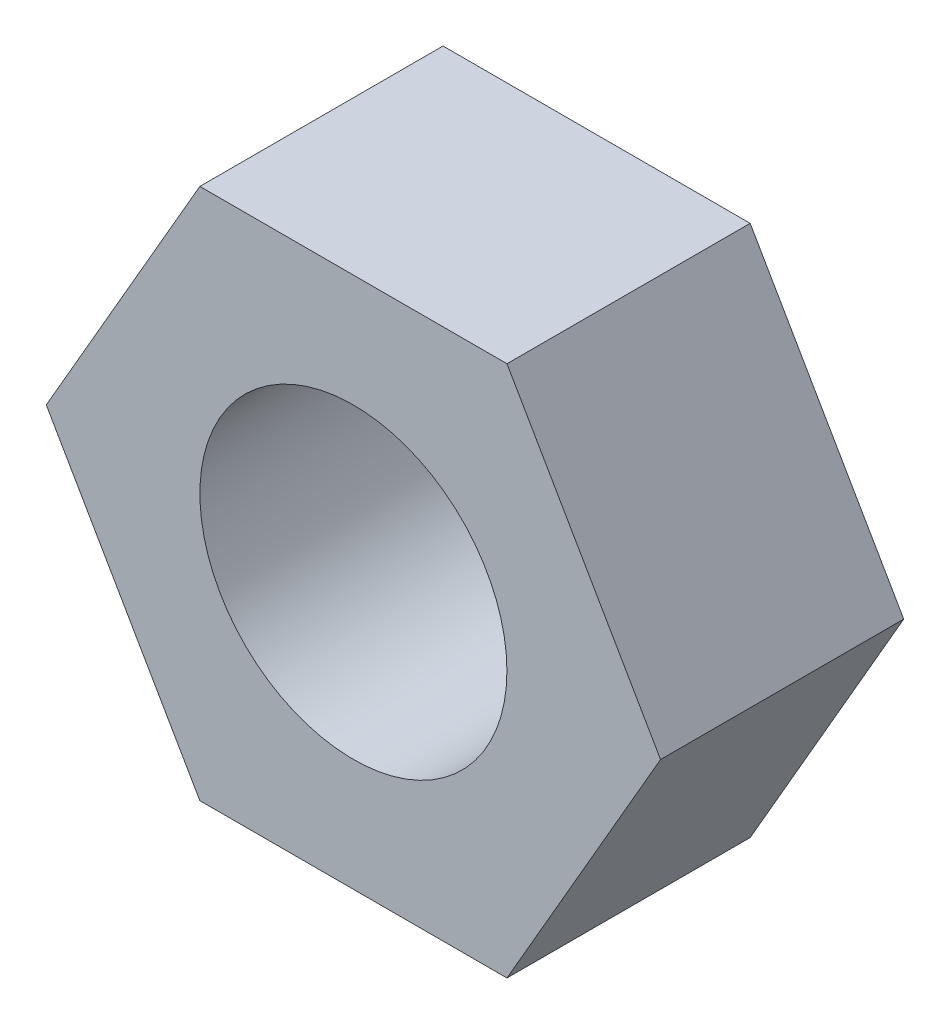
from build123d import *

# Parameters (mm, degrees)
HEX_BLANK_DEPTH                  = 3.2
NOMINAL_THREAD_ENVELOPE_START    = -1
SKETCH_NOMINAL_THREAD_ENVELOPE_R = 2.02
NOMINAL_THREAD_ENVELOPE_DEPTH    = 5.2


with BuildPart() as part:
    # Sketch_Hex_blank → Hex_blank (new body)
    with BuildSketch(Plane.XY):
        Polygon((4.041451884, 0), (2.020725942, 3.5), (-2.020725942, 3.5), (-4.041451884, 0), (-2.020725942, -3.5), (2.020725942, -3.5), align=None)
    extrude(amount=HEX_BLANK_DEPTH)

    # Sketch_Nominal_thread_envelope → Nominal_thread_envelope (cut)
    with BuildSketch(Plane.XY.offset(NOMINAL_THREAD_ENVELOPE_START)):
        Circle(SKETCH_NOMINAL_THREAD_ENVELOPE_R)
    extrude(amount=NOMINAL_THREAD_ENVELOPE_DEPTH, mode=Mode.SUBTRACT)


solid = part.part
